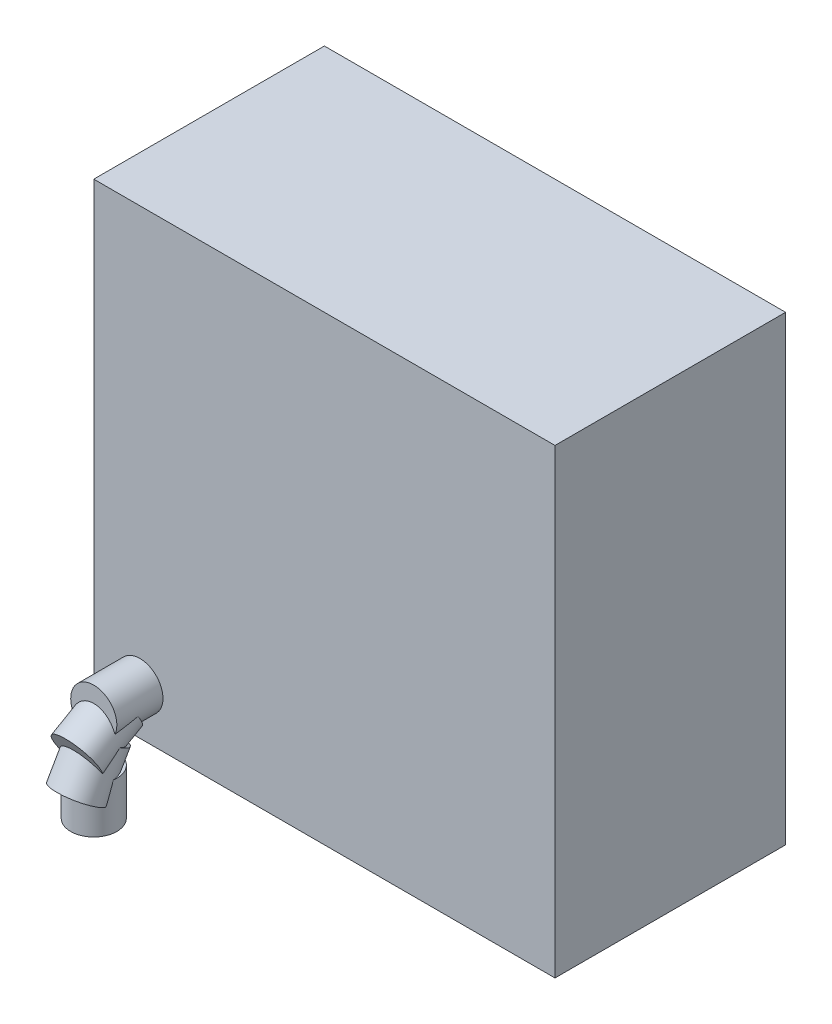
from build123d import *

# Parameters (mm, degrees)
SKETCH_1_W            = 20
SKETCH_1_H            = 20
BASEBOX_DEPTH         = 10
SKETCH_2_R            = 1
BOSSSEED_DEPTH        = 2
CIRCULARPATTERN_COUNT = 4
CIRCULARPATTERN_ANGLE = 90


with BuildPart() as part:
    # 草图1 → BaseBox (new body)
    with BuildSketch(Plane.XY):
        with Locations((10, 10)):
            Rectangle(SKETCH_1_W, SKETCH_1_H)
    extrude(amount=BASEBOX_DEPTH)

    # 草图2 → BossSeed (add)
    with BuildSketch(Plane.XY.offset(10)):
        with Locations((2, 2)):
            Circle(SKETCH_2_R)
    bossseed = extrude(amount=BOSSSEED_DEPTH)

    # CircularPattern: BossSeed ×4 about axis
    circularpattern_axis = Axis((0, 0, 10), (1, 0, 0))
    for i in range(1, CIRCULARPATTERN_COUNT):
        add(bossseed.rotate(circularpattern_axis, i * CIRCULARPATTERN_ANGLE / (CIRCULARPATTERN_COUNT - 1)))


solid = part.part
